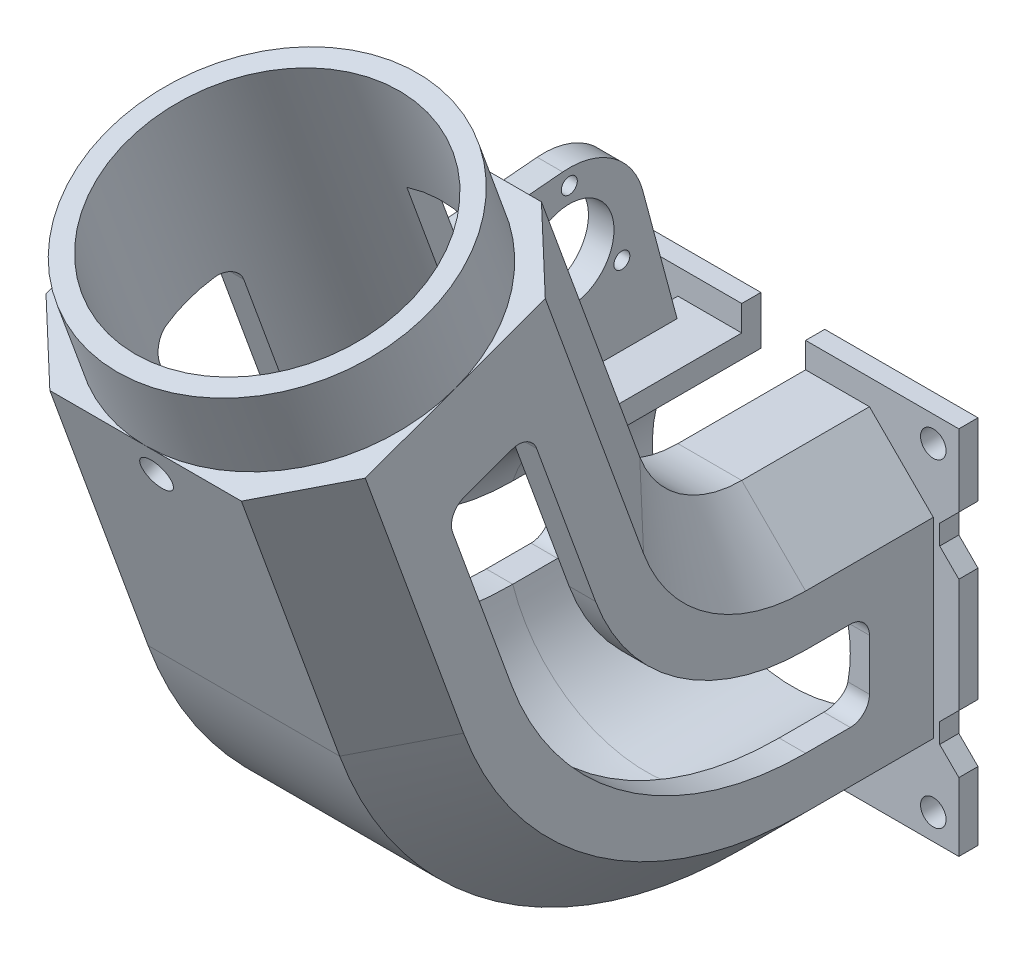
from build123d import *

# Parameters (mm, degrees)
SKETCH_1_W               = 58
SKETCH_1_H               = 58
SKETCH_1_R               = 22
SKETCH_1_R_2             = 2
EXTRUDE_1_DEPTH          = 3
SKETCH_2_R               = 22
EXTRUDE_2_DEPTH          = 20
SKETCH_4_R               = 22
SKETCH_5_R               = 22
EXTRUDE_3_DEPTH          = 45
CUT_EXTRUDE_1_DEPTH      = 5
CUT_EXTRUDE_1_DEPTH_BACK = 5
SKETCH_6_R               = 43.5
SKETCH_11_R              = 25
SKETCH_11_R_2            = 22
EXTRUDE_7_DEPTH          = 3
SKETCH_12_R              = 25
SKETCH_12_R_2            = 22
EXTRUDE_8_DEPTH          = 10
SKETCH2_R                = 11.9
SKETCH2_R_2              = 7
SKETCH2_R_3              = 1.25
EXTRUDE1_DEPTH           = 4
CUT_EXTRUDE1_DEPTH       = 51
CUT_EXTRUDE2_DEPTH       = 3
SKETCH5_R                = 2.5
CUT_EXTRUDE3_DEPTH       = 10


with BuildPart() as part:
    # 草图1 → 凸台-拉伸1 (new body)
    with BuildSketch(Plane.XY):
        with Locations((0, 29)):
            Rectangle(SKETCH_1_W, SKETCH_1_H)
        with Locations((0, 29)):
            Circle(SKETCH_1_R, mode=Mode.SUBTRACT)
        with Locations((-25, 54)):
            Circle(SKETCH_1_R_2, mode=Mode.SUBTRACT)
        with Locations((25, 54)):
            Circle(SKETCH_1_R_2, mode=Mode.SUBTRACT)
        with Locations((25, 4)):
            Circle(SKETCH_1_R_2, mode=Mode.SUBTRACT)
        with Locations((-25, 4)):
            Circle(SKETCH_1_R_2, mode=Mode.SUBTRACT)
    extrude(amount=EXTRUDE_1_DEPTH)

    # 草图2 → 凸台-拉伸2 (add)
    with BuildSketch(Plane.XY.offset(3)):
        Polygon((-25, 44), (-15, 54), (15, 54), (25, 44), (25, 14), (15, 4), (-15, 4), (-25, 14), align=None)
        with Locations((0, 29)):
            Circle(SKETCH_2_R, mode=Mode.SUBTRACT)
    extrude(amount=EXTRUDE_2_DEPTH)

    # 扫描1: sweep along a path in 草图3
    with BuildLine(Plane(origin=(0, 0, 0), x_dir=(0, 0, -1), z_dir=(1, 0, 0))) as sweep_1_path:
        ThreePointArc((-62.467090073, 56.63515398), (-47.090210327, 36.59561414), (-23, 29))
    # 草图4 → 扫描1 (sweep)
    with BuildSketch(Plane.XY.offset(23)):
        Polygon((-25, 44), (-25, 14), (-15, 4), (15, 4), (25, 14), (25, 44), (15, 54), (-15, 54), align=None)
        with Locations((0, 29)):
            Circle(SKETCH_4_R, mode=Mode.SUBTRACT)
    sweep(path=sweep_1_path.line)

    # 草图5 → 凸台-拉伸3 (add)
    with BuildSketch(Plane(origin=(0, 70.086635242, 25.509449048), x_dir=(1, 0, 0), z_dir=(0, 0.9396926207859096, 0.34202014332566555))):
        Polygon((-15, -14.329500102), (-25, -24.329500102), (-25, -54.329500102), (-15, -64.329500102), (15, -64.329500102), (25, -54.329500102), (25, -24.329500102), (15, -14.329500102), align=None)
        with Locations(Location((0, -39.329500102, 0), (0, 0, 270))):
            Circle(SKETCH_5_R, mode=Mode.SUBTRACT)
    extrude(amount=EXTRUDE_3_DEPTH)

    # 草图6 → 切除-拉伸1 (cut, two sides: drawn at the far end of the back side and taken through both)
    with BuildSketch(Plane(origin=(0, 0, 0), x_dir=(0, 0, -1), z_dir=(1, 0, 0)).offset(-CUT_EXTRUDE_1_DEPTH_BACK)):
        with Locations((-23, 71)):
            Circle(SKETCH_6_R)
    extrude(amount=CUT_EXTRUDE_1_DEPTH + CUT_EXTRUDE_1_DEPTH_BACK, mode=Mode.SUBTRACT)

    # 草图11 → 凸台-拉伸7 (add)
    with BuildSketch(Plane(origin=(0, 112.372803177, 40.900355498), x_dir=(1, 0, 0), z_dir=(0, 0.9396926207859096, 0.3420201433256655))):
        with Locations(Location((0, -39.329500102, 0), (0, 0, 270))):
            Circle(SKETCH_11_R)
        with Locations(Location((0, -39.329500102, 0), (0, 0, 103.136558787))):
            Circle(SKETCH_11_R_2, mode=Mode.SUBTRACT)
    extrude(amount=EXTRUDE_7_DEPTH)

    # 草图12 → 凸台-拉伸8 (add)
    with BuildSketch(Plane(origin=(0, 115.19188104, 41.926415928), x_dir=(1, 0, 0), z_dir=(0, 0.9396926207859096, 0.34202014332566555))):
        with Locations(Location((0, -39.329500102, 0), (0, 0, 270))):
            Circle(SKETCH_12_R)
        with Locations(Location((0, -39.329500102, 0), (0, 0, 103.136558787))):
            Circle(SKETCH_12_R_2, mode=Mode.SUBTRACT)
    extrude(amount=EXTRUDE_8_DEPTH)

    # Sketch2 → Extrude1 (add)
    # profile 1 of 2: a face of its own
    with BuildSketch(Plane(origin=(-16, 0, 0), x_dir=(0, 0, -1), z_dir=(1, 0, 0))):
        with BuildLine():
            ThreePointArc((-11.1, 71), (-31.039523471, 62.226399692), (-24.037153339, 82.854716907))
            Line((-24.037153339, 82.854716907), (-46.297321767, 80.907204522))
            Line((-46.297321767, 80.907204522), (-37.464873971, 56.640253643))
            Line((-37.464873971, 56.640253643), (-28.143847274, 52.683572923))
            Line((-28.143847274, 52.683572923), (-5.77234161, 52.683572923))
            Line((-5.77234161, 52.683572923), (-11.505482667, 74.079946637))
            ThreePointArc((-11.505482667, 74.079946637), (-11.20180615, 72.553261687), (-11.1, 71))
        make_face()
    # profile 2 of 2: a face of its own
    with BuildSketch(Plane(origin=(-16, 0, 0), x_dir=(0, 0, -1), z_dir=(1, 0, 0))):
        with Locations((-23, 71)):
            Circle(SKETCH2_R)
        with Locations((-23, 71)):
            Circle(SKETCH2_R_2, mode=Mode.SUBTRACT)
        with Locations((-14.772758664, 66.25)):
            Circle(SKETCH2_R_3, mode=Mode.SUBTRACT)
        with Locations((-31.227241336, 66.25)):
            Circle(SKETCH2_R_3, mode=Mode.SUBTRACT)
        with Locations((-23, 80.5)):
            Circle(SKETCH2_R_3, mode=Mode.SUBTRACT)
    extrude(amount=EXTRUDE1_DEPTH)

    # Sketch3 → Cut-Extrude1 (cut)
    with BuildSketch(Plane(origin=(25, 0, 0), x_dir=(0, 0, -1), z_dir=(1, 0, 0))):
        with BuildLine():
            Line((-68.96892389, 86.194013177), (-76.486464856, 83.457852031))
            ThreePointArc((-76.486464856, 83.457852031), (-78.179327787, 81.906628953), (-78.279482288, 79.612713738))
            Line((-78.279482288, 79.612713738), (-69.044938419, 54.241012977))
            ThreePointArc((-69.044938419, 54.241012977), (-51.105245381, 30.86154983), (-23, 22))
            Line((-23, 22), (-16, 22))
            ThreePointArc((-16, 22), (-13.878679656, 22.878679656), (-13, 25))
            Line((-13, 25), (-13, 33))
            ThreePointArc((-13, 33), (-13.878679656, 35.121320344), (-16, 36))
            Line((-16, 36), (-23, 36))
            ThreePointArc((-23, 36), (-43.075175272, 42.32967845), (-55.889241728, 59.029294984))
            Line((-55.889241728, 59.029294984), (-65.123785597, 84.400995745))
            ThreePointArc((-65.123785597, 84.400995745), (-66.675008674, 86.093858676), (-68.96892389, 86.194013177))
        make_face()
    extrude(amount=-CUT_EXTRUDE1_DEPTH, mode=Mode.SUBTRACT)

    # Sketch4 → Cut-Extrude2 (cut)
    with BuildSketch(Plane(origin=(0, 0, 0), x_dir=(-1, 0, 0), z_dir=(0, 0, -1))):
        Polygon((-26, 16.795799061), (-29, 19.795799061), (-29, 10.7), (-26, 13.7), align=None)
        Polygon((-26, 43.7), (-29, 46.7), (-29, 37.604200939), (-26, 40.604200939), align=None)
        Polygon((26, 40.604200939), (29, 37.604200939), (29, 46.7), (26, 43.7), align=None)
        Polygon((29, 19.795799061), (26, 16.795799061), (26, 13.7), (29, 10.7), align=None)
    extrude(amount=-CUT_EXTRUDE2_DEPTH, mode=Mode.SUBTRACT)

    # Sketch5 → Cut-Extrude3 (cut)
    with BuildSketch(Plane(origin=(0, -22.001984845, 60.449956545), x_dir=(1, 0, 0), z_dir=(0, -0.3420201433256656, 0.9396926207859096))):
        with Locations(Location((0, 114.584639372, 0), (0, 0, 270))):
            Circle(SKETCH5_R)
    extrude(amount=-CUT_EXTRUDE3_DEPTH, mode=Mode.SUBTRACT)


solid = part.part
